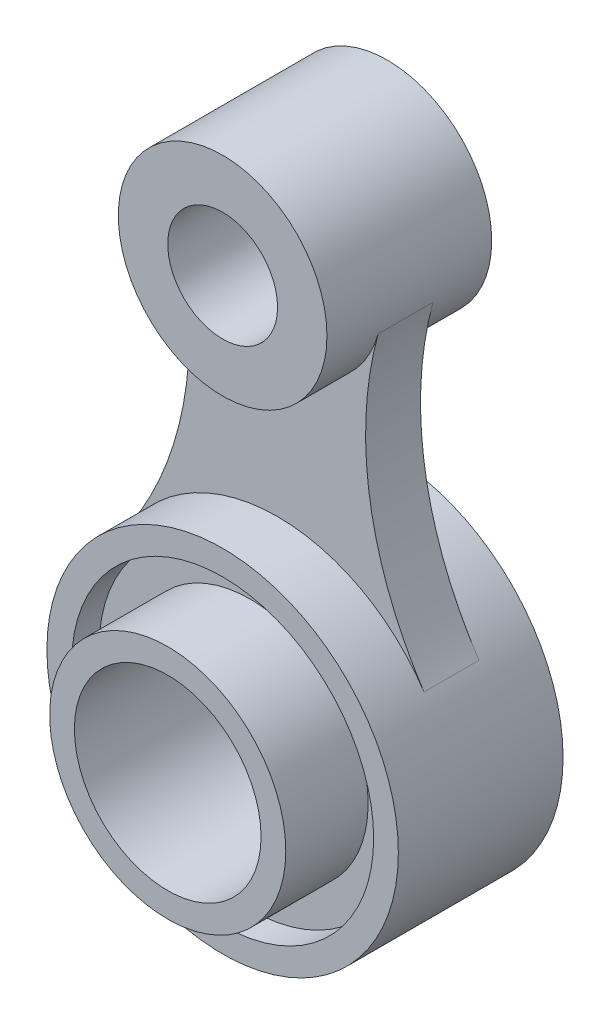
from build123d import *

# Parameters (mm, degrees)
SKETCH2_R                = 32
SKETCH2_R_2              = 27.5
BOSS_EXTRUDE1_DEPTH      = 30
BOSS_EXTRUDE2_DEPTH      = 5
BOSS_EXTRUDE2_DEPTH_BACK = 5
BOSS_EXTRUDE3_DEPTH      = 15
BOSS_EXTRUDE3_DEPTH_BACK = 15
SKETCH4_R                = 19
SKETCH4_R_2              = 10
BOSS_EXTRUDE4_DEPTH      = 10
BOSS_EXTRUDE4_DEPTH_BACK = 15
SKETCH5_R                = 27.5
SKETCH6_R                = 21.5
BOSS_EXTRUDE5_DEPTH      = 15
SKETCH7_R                = 17
CUT_EXTRUDE1_DEPTH       = 40


with BuildPart() as part:
    # Sketch2 → Boss-Extrude1 (new body)
    with BuildSketch(Plane.XY):
        Circle(SKETCH2_R)
        Circle(SKETCH2_R_2, mode=Mode.SUBTRACT)
    extrude(amount=BOSS_EXTRUDE1_DEPTH)

    # Sketch3 → Boss-Extrude2 (add, two sides: drawn at the far end of the back side and taken through both)
    with BuildSketch(Plane.XY.offset(15).offset(-BOSS_EXTRUDE2_DEPTH_BACK)):
        with BuildLine():
            ThreePointArc((-18.321243986, 69.966907631), (0, 56), (18.321243986, 69.966907631))
            ThreePointArc((18.321243986, 69.966907631), (16.836772686, 42.914041255), (26.678302647, 17.671111111))
            ThreePointArc((26.678302647, 17.671111111), (0, 32), (-26.678302647, 17.671111111))
            ThreePointArc((-26.678302647, 17.671111111), (-16.836772686, 42.914041255), (-18.321243986, 69.966907631))
        make_face()
    extrude(amount=BOSS_EXTRUDE2_DEPTH + BOSS_EXTRUDE2_DEPTH_BACK)

    # Sketch4 → Boss-Extrude3 (add, two sides: drawn at the far end of the back side and taken through both)
    with BuildSketch(Plane.XY.offset(15).offset(-BOSS_EXTRUDE3_DEPTH_BACK)):
        with Locations((0, 75)):
            Circle(SKETCH4_R)
        with Locations((0, 75)):
            Circle(SKETCH4_R_2, mode=Mode.SUBTRACT)
    extrude(amount=BOSS_EXTRUDE3_DEPTH + BOSS_EXTRUDE3_DEPTH_BACK)

    # Sketch5 → Boss-Extrude4 (add, two sides: drawn at the far end of the back side and taken through both)
    with BuildSketch(Plane.XY.offset(15).offset(-BOSS_EXTRUDE4_DEPTH_BACK)):
        Circle(SKETCH5_R)
    extrude(amount=BOSS_EXTRUDE4_DEPTH + BOSS_EXTRUDE4_DEPTH_BACK)

    # Sketch6 → Boss-Extrude5 (add)
    with BuildSketch(Plane.XY.offset(25)):
        Circle(SKETCH6_R)
    extrude(amount=BOSS_EXTRUDE5_DEPTH)

    # Sketch7 → Cut-Extrude1 (cut)
    with BuildSketch(Plane.XY.offset(40)):
        Circle(SKETCH7_R)
    extrude(amount=-CUT_EXTRUDE1_DEPTH, mode=Mode.SUBTRACT)


solid = part.part
